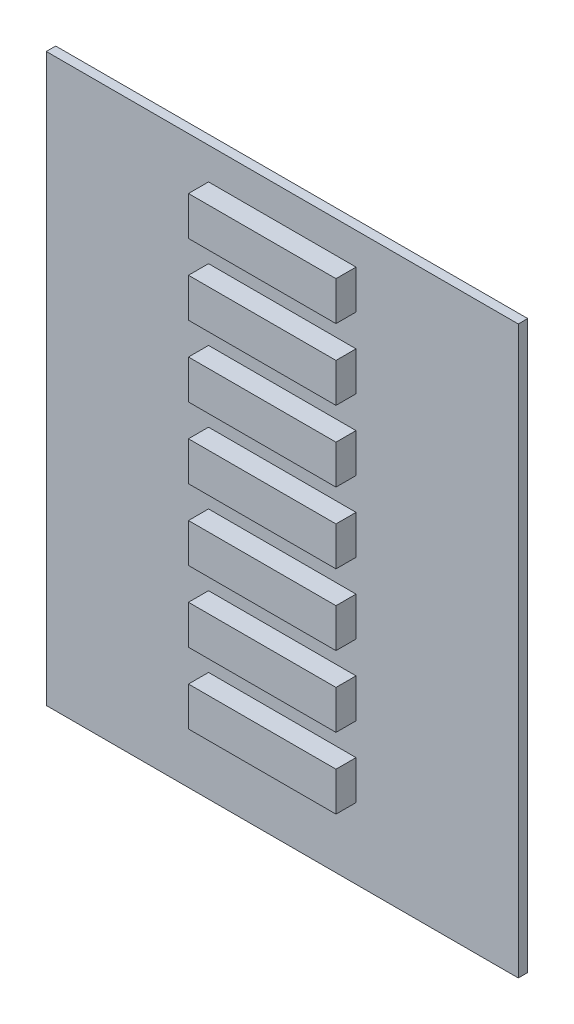
from build123d import *

# Parameters (mm, degrees)
SKETCH1_W           = 80
SKETCH1_H           = 96
BOSS_EXTRUDE1_DEPTH = 1.6
SKETCH3_W           = 25
SKETCH3_H           = 6.6
BOSS_EXTRUDE2_DEPTH = 5


with BuildPart() as part:
    # Sketch1 → Boss-Extrude1 (new body)
    with BuildSketch(Plane.XY.offset(-42.6)):
        Rectangle(SKETCH1_W, SKETCH1_H)
    extrude(amount=BOSS_EXTRUDE1_DEPTH)

    # Sketch3 → Boss-Extrude2 (add)
    with BuildSketch(Plane.XY.offset(-42.6)):
        with Locations((0, 39.3)):
            Rectangle(SKETCH3_W, SKETCH3_H)
        with Locations((0, 27.3)):
            Rectangle(SKETCH3_W, SKETCH3_H)
        with Locations((0, 15.3)):
            Rectangle(SKETCH3_W, SKETCH3_H)
        with Locations((0, 3.3)):
            Rectangle(SKETCH3_W, SKETCH3_H)
        with Locations((0, -8.7)):
            Rectangle(SKETCH3_W, SKETCH3_H)
        with Locations((0, -20.7)):
            Rectangle(SKETCH3_W, SKETCH3_H)
        with Locations((0, -32.7)):
            Rectangle(SKETCH3_W, SKETCH3_H)
    extrude(amount=BOSS_EXTRUDE2_DEPTH)


solid = part.part
